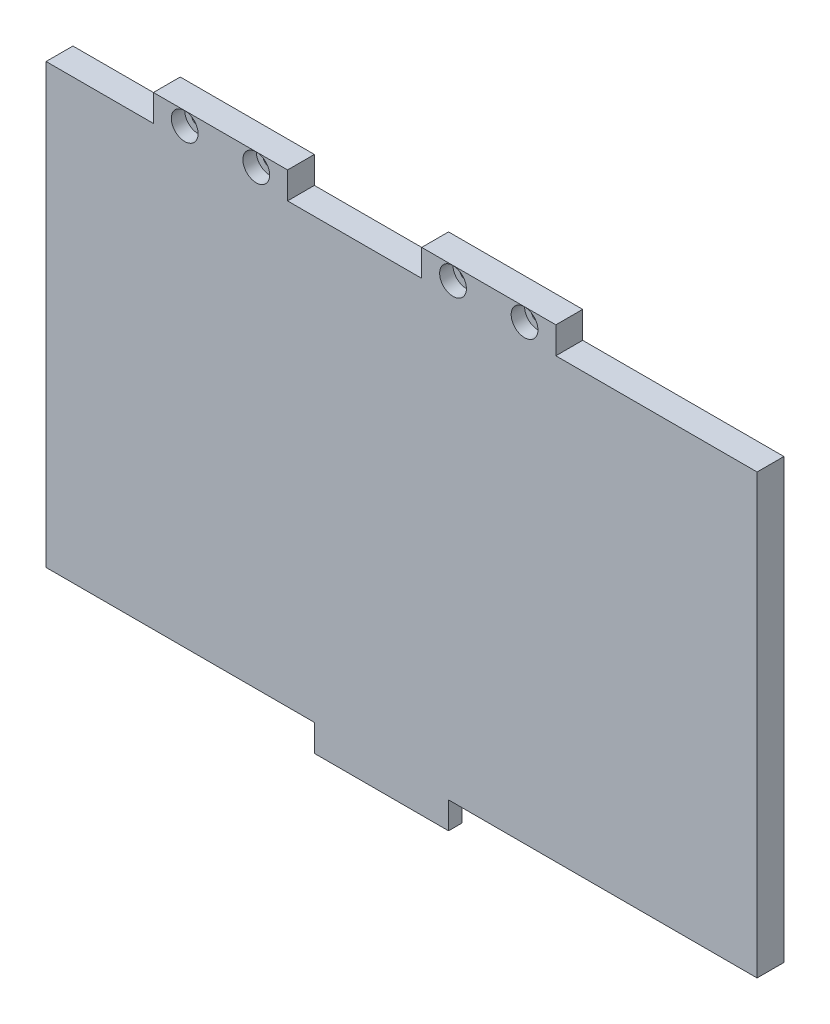
from build123d import *

# Parameters (mm, degrees)
ESQUISSE1_W             = 159
ESQUISSE1_H             = 104
BOSS_EXTRU_1_DEPTH      = 6
ESQUISSE2_W             = 24
ESQUISSE2_H             = 6
ESQUISSE2_W_2           = 45
ESQUISSE2_W_3           = 30
ENL_V_MAT_EXTRU_1_DEPTH = 191.086822268
ESQUISSE3_R             = 1.5
ENL_V_MAT_EXTRU_2_DEPTH = 191.086822268
ESQUISSE4_R             = 2.995
ENL_V_MAT_EXTRU_3_DEPTH = 3
ESQUISSE5_W             = 30
ESQUISSE5_H             = 6
BOSS_EXTRU_2_DEPTH      = 6
ESQUISSE6_W             = 30
ESQUISSE6_H             = 6
ENL_V_MAT_EXTRU_4_DEPTH = 3


with BuildPart() as part:
    # Esquisse1 → Boss.-Extru.1 (new body)
    with BuildSketch(Plane.XY):
        with Locations((-79.5, 52)):
            Rectangle(ESQUISSE1_W, ESQUISSE1_H)
    extrude(amount=BOSS_EXTRU_1_DEPTH)

    # Esquisse2 → Enlèv. mat.-Extru.1 (cut, through all)
    with BuildSketch(Plane.XY.offset(6)):
        with Locations((-147, 101)):
            Rectangle(ESQUISSE2_W, ESQUISSE2_H)
        with Locations((-22.5, 101)):
            Rectangle(ESQUISSE2_W_2, ESQUISSE2_H)
        with Locations((-90, 101)):
            Rectangle(ESQUISSE2_W_3, ESQUISSE2_H)
    extrude(amount=-ENL_V_MAT_EXTRU_1_DEPTH, mode=Mode.SUBTRACT)

    # Esquisse3 → Enlèv. mat.-Extru.2 (cut, through all)
    with BuildSketch(Plane.XY.offset(6)):
        with Locations((-128, 101)):
            Circle(ESQUISSE3_R)
        with Locations((-112, 101)):
            Circle(ESQUISSE3_R)
        with Locations((-68, 101)):
            Circle(ESQUISSE3_R)
        with Locations((-52, 101)):
            Circle(ESQUISSE3_R)
    extrude(amount=-ENL_V_MAT_EXTRU_2_DEPTH, mode=Mode.SUBTRACT)

    # Esquisse4 → Enlèv. mat.-Extru.3 (cut)
    with BuildSketch(Plane.XY.offset(6)):
        with Locations((-128, 101)):
            Circle(ESQUISSE4_R)
        with Locations((-112, 101)):
            Circle(ESQUISSE4_R)
        with Locations((-68, 101)):
            Circle(ESQUISSE4_R)
        with Locations((-52, 101)):
            Circle(ESQUISSE4_R)
    extrude(amount=-ENL_V_MAT_EXTRU_3_DEPTH, mode=Mode.SUBTRACT)

    # Esquisse5 → Boss.-Extru.2 (add)
    with BuildSketch(Plane.XZ):
        with Locations((-84, 3)):
            Rectangle(ESQUISSE5_W, ESQUISSE5_H)
    extrude(amount=BOSS_EXTRU_2_DEPTH)

    # Esquisse6 → Enlèv. mat.-Extru.4 (cut)
    with BuildSketch(Plane(origin=(0, 0, 0), x_dir=(-1, 0, 0), z_dir=(0, 0, -1))):
        with Locations((84, -3)):
            Rectangle(ESQUISSE6_W, ESQUISSE6_H)
    extrude(amount=-ENL_V_MAT_EXTRU_4_DEPTH, mode=Mode.SUBTRACT)


solid = part.part
